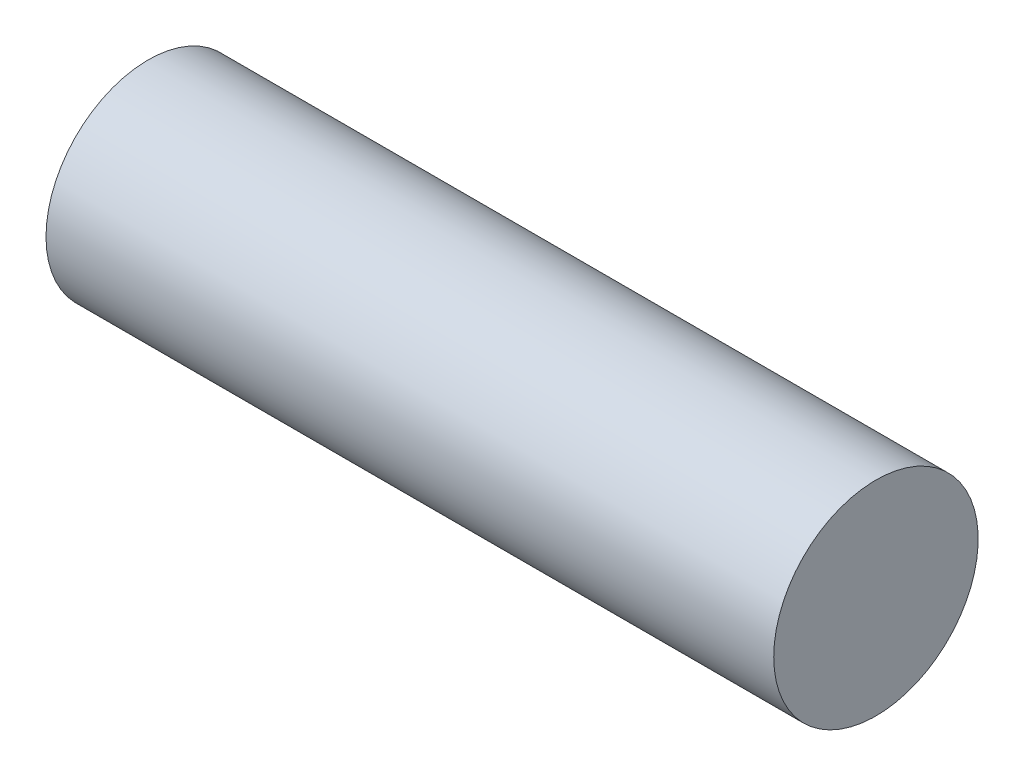
from build123d import *

# Parameters (mm, degrees)
ESQUISSE1_W = 315.189187025
ESQUISSE1_H = 44.271024872


with BuildPart() as part:
    # Esquisse1 → Révolution1 (revolve)
    with BuildSketch(Plane(origin=(0, 26.198285936, -67.096864843), x_dir=(1, 0, 0), z_dir=(0, 1, 0)), mode=Mode.PRIVATE) as r_volution1_sk:
        with Locations((-191.786439449, 16.895855249)):
            Rectangle(ESQUISSE1_W, ESQUISSE1_H)
    revolve(r_volution1_sk.sketch.rotate(Axis((-349.381032961, 26.198285936, -61.857207655), (1, 0, 0)), 180), axis=Axis((-349.381032961, 26.198285936, -61.857207655), (1, 0, 0)))


solid = part.part
